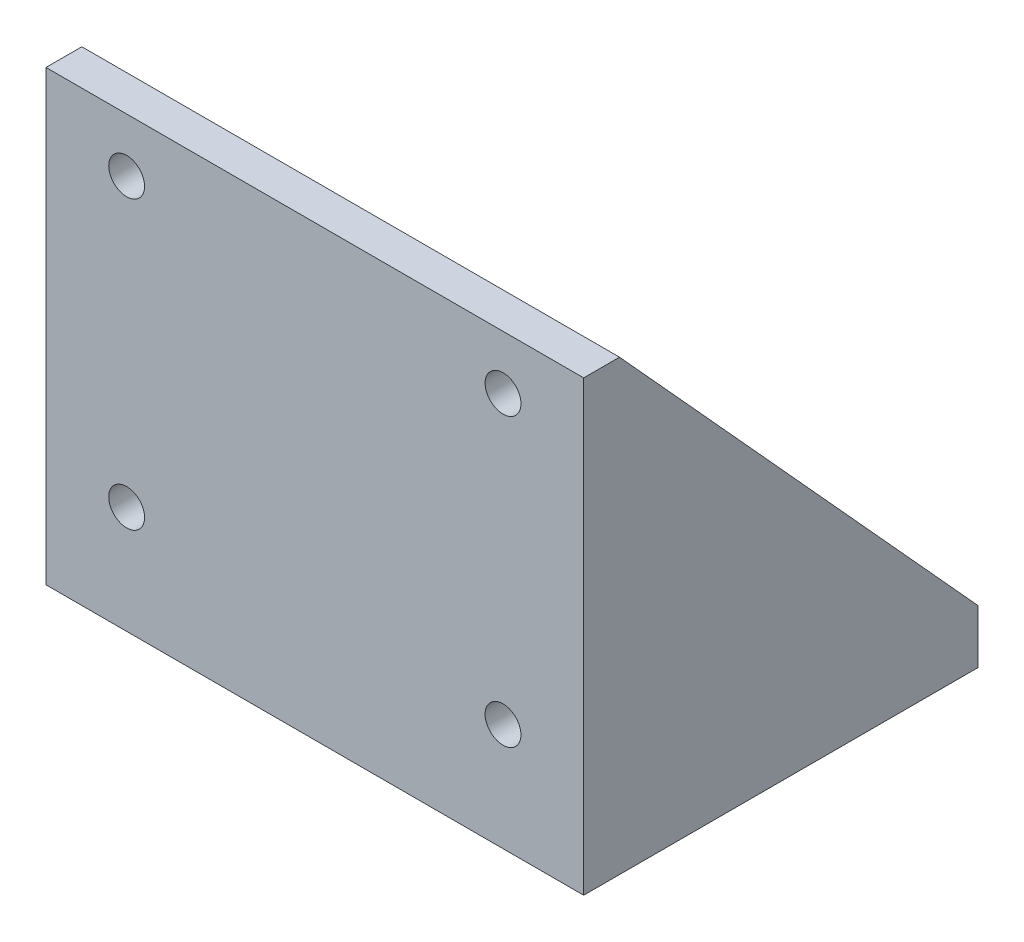
from build123d import *

# Parameters (mm, degrees)
ESQUISSE1_W                  = 60
ESQUISSE1_H                  = 6
BOSS_EXTRU_1_DEPTH           = 40
ENL_V_MAT_EXTRU_1_DEPTH      = 73.360210061
ENL_V_MAT_EXTRU_1_DEPTH_BACK = 73.360210061
ESQUISSE2_R                  = 5
ENL_V_MAT_EXTRU_3_DEPTH      = 73.360210061
ENL_V_MAT_EXTRU_3_DEPTH_BACK = 73.360210061
ESQUISSE4_R                  = 1.75
ESQUISSE7_W                  = 60
ESQUISSE7_H                  = 4
BOSS_EXTRU_2_DEPTH           = 50
BOSS_EXTRU_3_DEPTH           = 3
BOSS_EXTRU_4_START           = -60
BOSS_EXTRU_4_DEPTH           = 3
ENL_V_MAT_EXTRU_4_DEPTH      = 88.749643874
ENL_V_MAT_EXTRU_4_DEPTH_BACK = 88.749643874
ESQUISSE9_R                  = 2
CHANFREIN1_SIZE              = 1


with BuildPart() as part:
    # Esquisse1 → Boss.-Extru.1 (new body)
    with BuildSketch(Plane.XY):
        with Locations((30, 3)):
            Rectangle(ESQUISSE1_W, ESQUISSE1_H)
    extrude(amount=BOSS_EXTRU_1_DEPTH)

    # Esquisse2 → Enlèv. mat.-Extru.1 (cut, two sides: drawn at the far end of the back side and taken through both)
    with BuildSketch(Plane(origin=(0, 6, 0), x_dir=(1, 0, 0), z_dir=(0, 1, 0)).offset(-ENL_V_MAT_EXTRU_1_DEPTH_BACK)):
        with Locations(Location((30, -20, 0), (0, 0, 270))):
            Circle(ESQUISSE2_R)
    extrude(amount=ENL_V_MAT_EXTRU_1_DEPTH + ENL_V_MAT_EXTRU_1_DEPTH_BACK, mode=Mode.SUBTRACT)

    # Esquisse4 → Enlèv. mat.-Extru.3 (cut, two sides: drawn at the far end of the back side and taken through both)
    with BuildSketch(Plane(origin=(0, 6, 0), x_dir=(1, 0, 0), z_dir=(0, 1, 0)).offset(-ENL_V_MAT_EXTRU_3_DEPTH_BACK)):
        with Locations(Location((45, -20, 0), (0, 0, 270))):
            Circle(ESQUISSE4_R)
        with Locations(Location((22.5, -32.990381057, 0), (0, 0, 270))):
            Circle(ESQUISSE4_R)
        with Locations(Location((22.5, -7.009618943, 0), (0, 0, 270))):
            Circle(ESQUISSE4_R)
    extrude(amount=ENL_V_MAT_EXTRU_3_DEPTH + ENL_V_MAT_EXTRU_3_DEPTH_BACK, mode=Mode.SUBTRACT)

    # Esquisse7 → Boss.-Extru.2 (add)
    with BuildSketch(Plane.XZ):
        with Locations((30, 42)):
            Rectangle(ESQUISSE7_W, ESQUISSE7_H)
    extrude(amount=-BOSS_EXTRU_2_DEPTH)

    # Esquisse8 → Boss.-Extru.3 (add)
    with BuildSketch(Plane(origin=(60, 0, 0), x_dir=(0, 0, -1), z_dir=(1, 0, 0))):
        Polygon((0, 6), (-40, 50), (-40, 6), align=None)
    extrude(amount=-BOSS_EXTRU_3_DEPTH)

    # Esquisse8<2> → Boss.-Extru.4 (add)
    with BuildSketch(Plane(origin=(60, 0, 0), x_dir=(0, 0, -1), z_dir=(1, 0, 0)).offset(BOSS_EXTRU_4_START)):
        Polygon((0, 6), (-40, 50), (-40, 6), align=None)
    extrude(amount=BOSS_EXTRU_4_DEPTH)

    # Esquisse9 → Enlèv. mat.-Extru.4 (cut, two sides: drawn at the far end of the back side and taken through both)
    with BuildSketch(Plane(origin=(0, 0, 40), x_dir=(-1, 0, 0), z_dir=(0, 0, -1)).offset(-ENL_V_MAT_EXTRU_4_DEPTH_BACK)):
        with Locations((-51, 12)):
            Circle(ESQUISSE9_R)
        with Locations((-51, 44)):
            Circle(ESQUISSE9_R)
        with Locations((-9, 44)):
            Circle(ESQUISSE9_R)
        with Locations((-9, 12)):
            Circle(ESQUISSE9_R)
    extrude(amount=ENL_V_MAT_EXTRU_4_DEPTH + ENL_V_MAT_EXTRU_4_DEPTH_BACK, mode=Mode.SUBTRACT)

    # Chanfrein1
    chanfrein1_edges = [part.edges().sort_by_distance(p)[0] for p in [
        (11, 12, 40),
        (11, 44, 40),
        (53, 44, 40),
        (53, 12, 40),
    ]]
    chamfer(chanfrein1_edges, length=CHANFREIN1_SIZE)


solid = part.part
